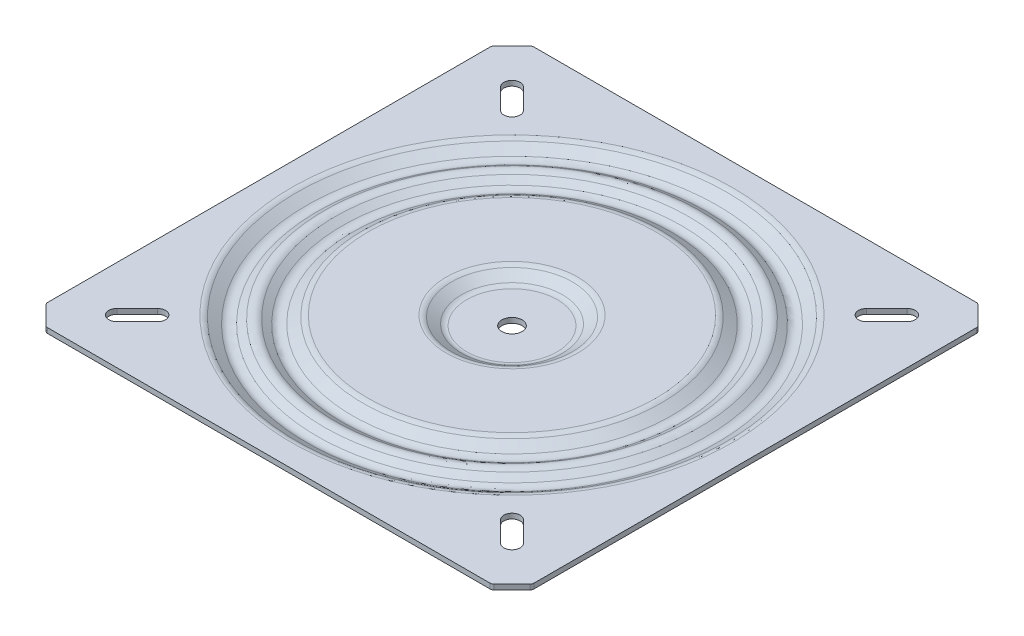
from build123d import *

# Parameters (mm, degrees)
SKETCH2_W           = 240
SKETCH2_H           = 240
SKETCH2_R           = 115
BOSS_EXTRUDE1_DEPTH = 2.5
SKETCH3_R           = 5
CUT_EXTRUDE1_DEPTH  = 170.870462818
CHAMFER1_SIZE       = 10
FILLET1_R           = 2


with BuildPart() as part:
    # Sketch1 → Revolve1 (revolve)
    with BuildSketch(Plane.XY):
        with BuildLine():
            Line((71.076263006, 0), (32.5, 0))
            ThreePointArc((32.5, 0), (31.130693606, -0.191153985), (29.866086562, -0.75))
            Line((29.866086562, -0.75), (24.960176445, -3.79041002))
            ThreePointArc((24.960176445, -3.79041002), (23.6955694, -4.349256035), (22.326263006, -4.54041002))
            Line((22.326263006, -4.54041002), (0, -4.54041002))
            Line((0, -4.54041002), (0, -7.04041002))
            Line((0, -7.04041002), (23.038131503, -7.04041002))
            ThreePointArc((23.038131503, -7.04041002), (24.407437897, -6.849256035), (25.672044941, -6.29041002))
            Line((25.672044941, -6.29041002), (30.577955059, -3.25))
            ThreePointArc((30.577955059, -3.25), (31.842562103, -2.691153985), (33.211868497, -2.5))
            Line((33.211868497, -2.5), (70.36439451, -2.5))
            ThreePointArc((70.36439451, -2.5), (71.733700903, -2.691153985), (72.998307948, -3.25))
            Line((72.998307948, -3.25), (78.616086562, -6.73158649))
            ThreePointArc((78.616086562, -6.73158649), (81.25, -7.48158649), (83.883913438, -6.73158649))
            Line((83.883913438, -6.73158649), (86.839303874, -4.9))
            ThreePointArc((86.839303874, -4.9), (90, -4), (93.160696126, -4.9))
            Line((93.160696126, -4.9), (96.116086562, -6.73158649))
            ThreePointArc((96.116086562, -6.73158649), (98.75, -7.48158649), (101.383913438, -6.73158649))
            Line((101.383913438, -6.73158649), (107.001692052, -3.25))
            ThreePointArc((107.001692052, -3.25), (108.266299097, -2.691153985), (109.63560549, -2.5))
            Line((109.63560549, -2.5), (115, -2.5))
            Line((115, -2.5), (115, 0))
            Line((115, 0), (108.923736994, 0))
            ThreePointArc((108.923736994, 0), (107.5544306, -0.191153985), (106.289823555, -0.75))
            Line((106.289823555, -0.75), (101.383913438, -3.79041002))
            ThreePointArc((101.383913438, -3.79041002), (98.75, -4.54041002), (96.116086562, -3.79041002))
            Line((96.116086562, -3.79041002), (92.633913438, -1.632352941))
            ThreePointArc((92.633913438, -1.632352941), (90, -0.882352941), (87.366086562, -1.632352941))
            Line((87.366086562, -1.632352941), (83.883913438, -3.79041002))
            ThreePointArc((83.883913438, -3.79041002), (81.25, -4.54041002), (78.616086562, -3.79041002))
            Line((78.616086562, -3.79041002), (73.710176445, -0.75))
            ThreePointArc((73.710176445, -0.75), (72.4455694, -0.191153985), (71.076263006, 0))
        make_face()
    revolve(axis=Axis((0, -2.5, 0), (0, 1, 0)))

    # Sketch2 → Boss-Extrude1 (add)
    with BuildSketch(Plane(origin=(0, 0, 0), x_dir=(1, 0, 0), z_dir=(0, 1, 0))):
        Rectangle(SKETCH2_W, SKETCH2_H)
        Circle(SKETCH2_R, mode=Mode.SUBTRACT)
    extrude(amount=-BOSS_EXTRUDE1_DEPTH)

    # Sketch3 → Cut-Extrude1 (cut, through all)
    with BuildSketch(Plane(origin=(0, 0, 0), x_dir=(1, 0, 0), z_dir=(0, 1, 0))):
        Circle(SKETCH3_R)
        with BuildLine():
            Line((-94.671572875, 100.328427125), (-84.671572875, 90.328427125))
            ThreePointArc((-84.671572875, 90.328427125), (-84.671572875, 84.671572875), (-90.328427125, 84.671572875))
            Line((-90.328427125, 84.671572875), (-100.328427125, 94.671572875))
            ThreePointArc((-100.328427125, 94.671572875), (-100.328427125, 100.328427125), (-94.671572875, 100.328427125))
        make_face()
        with BuildLine():
            Line((94.671572875, 100.328427125), (84.671572875, 90.328427125))
            ThreePointArc((84.671572875, 90.328427125), (84.671572875, 84.671572875), (90.328427125, 84.671572875))
            Line((90.328427125, 84.671572875), (100.328427125, 94.671572875))
            ThreePointArc((100.328427125, 94.671572875), (100.328427125, 100.328427125), (94.671572875, 100.328427125))
        make_face()
        with BuildLine():
            Line((100.328427125, -94.671572875), (90.328427125, -84.671572875))
            ThreePointArc((90.328427125, -84.671572875), (84.671572875, -84.671572875), (84.671572875, -90.328427125))
            Line((84.671572875, -90.328427125), (94.671572875, -100.328427125))
            ThreePointArc((94.671572875, -100.328427125), (100.328427125, -100.328427125), (100.328427125, -94.671572875))
        make_face()
        with BuildLine():
            Line((-94.671572875, -100.328427125), (-84.671572875, -90.328427125))
            ThreePointArc((-84.671572875, -90.328427125), (-84.671572875, -84.671572875), (-90.328427125, -84.671572875))
            Line((-90.328427125, -84.671572875), (-100.328427125, -94.671572875))
            ThreePointArc((-100.328427125, -94.671572875), (-100.328427125, -100.328427125), (-94.671572875, -100.328427125))
        make_face()
    extrude(amount=-CUT_EXTRUDE1_DEPTH, mode=Mode.SUBTRACT)

    # Chamfer1
    chamfer1_edges = [part.edges().sort_by_distance(p)[0] for p in [
        (-120, -1.25, -120),
        (120, -1.25, -120),
        (120, -1.25, 120),
        (-120, -1.25, 120),
    ]]
    chamfer(chamfer1_edges, length=CHAMFER1_SIZE)

    # Fillet1
    fillet1_edges = [part.edges().sort_by_distance(p)[0] for p in [
        (-110, -1.25, 120),
        (-120, -1.25, 110),
        (110, -1.25, 120),
        (120, -1.25, 110),
        (120, -1.25, -110),
        (110, -1.25, -120),
        (-120, -1.25, -110),
        (-110, -1.25, -120),
    ]]
    fillet(fillet1_edges, radius=FILLET1_R)


solid = part.part
